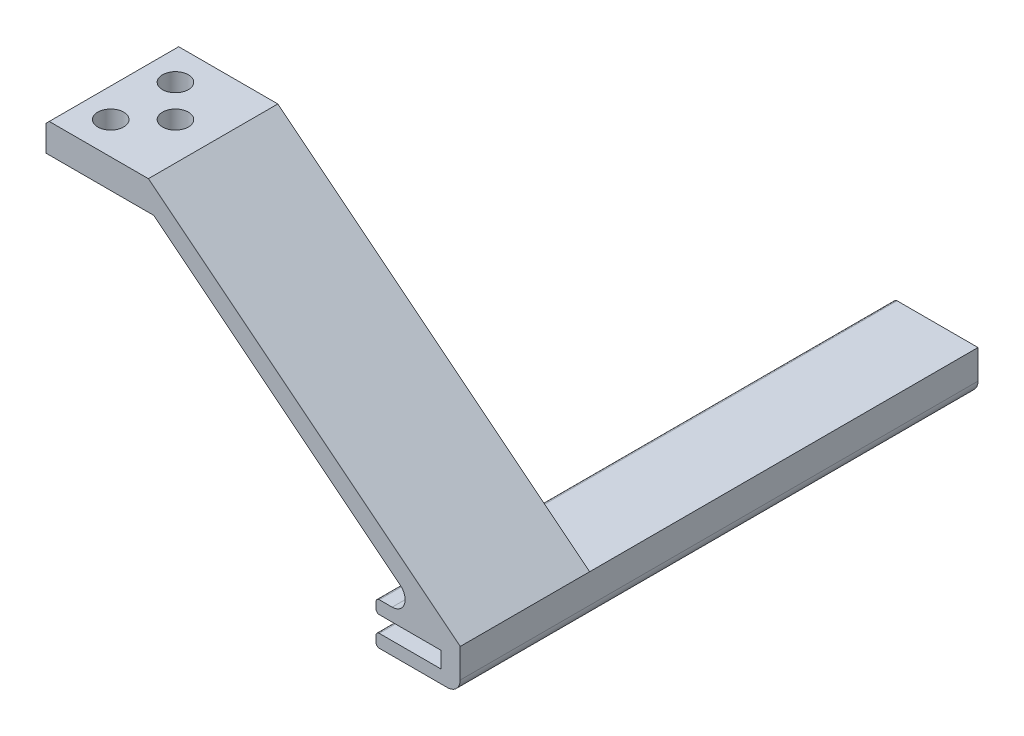
from build123d import *

# Parameters (mm, degrees)
EXTRUDE_1_DEPTH     = 20
SKETCH_2_R          = 2.5
SKETCH_2_W          = 0.5
SKETCH_2_H          = 5
CUT_EXTRUDE_1_DEPTH = 7
FILLET_2_R          = 1
EXTRUDE_START       = 60
EXTRUDE_2_DEPTH     = 60
SKETCH_4_R          = 2
CUT_EXTRUDE_2_DEPTH = 5
CHAMFER_1_SIZE      = 0.5


with BuildPart() as part:
    # 草图1 → 凸台-拉伸1 (new body)
    with BuildSketch(Plane.XY):
        with BuildLine():
            Line((51.5, 0), (62, 0))
            ThreePointArc((62, 0), (63.414213562, 0.585786438), (64, 2))
            Line((64, 2), (64, 6.5))
            Line((64, 6.5), (15.818440015, 45))
            Line((15.818440015, 45), (0, 45))
            Line((0, 45), (0, 40))
            Line((0, 40), (17.27, 40))
            Line((17.27, 40), (54.735914555, 10.062453129))
            ThreePointArc((54.735914555, 10.062453129), (55.374865565, 7.838526742), (53.487419373, 6.5))
            Line((53.487419373, 6.5), (51.5, 6.5))
            ThreePointArc((51.5, 6.5), (51.146446609, 6.353553391), (51, 6))
            Line((51, 6), (51, 5))
            ThreePointArc((51, 5), (51.146446609, 4.646446609), (51.5, 4.5))
            Line((51.5, 4.5), (61, 4.5))
            Line((61, 4.5), (61, 2))
            Line((61, 2), (51.5, 2))
            ThreePointArc((51.5, 2), (51.146446609, 1.853553391), (51, 1.5))
            Line((51, 1.5), (51, 0.5))
            ThreePointArc((51, 0.5), (51.146446609, 0.146446609), (51.5, 0))
        make_face()
    extrude(amount=EXTRUDE_1_DEPTH)

    # 草图2 → 切除-拉伸1 (cut)
    with BuildSketch(Plane.XZ):
        with Locations((57, 14)):
            Circle(SKETCH_2_R)
        with BuildLine():
            Line((57, 16.5), (51.5, 16.5))
            Line((51.5, 16.5), (51.5, 11.5))
            Line((51.5, 11.5), (57, 11.5))
            ThreePointArc((57, 11.5), (54.5, 14), (57, 16.5))
        make_face()
        with Locations((51.25, 14)):
            Rectangle(SKETCH_2_W, SKETCH_2_H)
    extrude(amount=-CUT_EXTRUDE_1_DEPTH, mode=Mode.SUBTRACT)

    # 圆角2
    fillet_2_edges = [part.edges().sort_by_distance(p)[0] for p in [
        (54.810295028, 7, 14),
    ]]
    fillet(fillet_2_edges, radius=FILLET_2_R)

    # 草图3 → 凸台-拉伸2 (add)
    with BuildSketch(Plane(origin=(0, 0, 0), x_dir=(-1, 0, 0), z_dir=(0, 0, -1)).offset(EXTRUDE_START)):
        with BuildLine():
            Line((-64, 6.5), (-53.487419373, 6.5))
            Line((-53.487419373, 6.5), (-51.5, 6.5))
            ThreePointArc((-51.5, 6.5), (-51.146446609, 6.353553391), (-51, 6))
            Line((-51, 6), (-51, 5))
            ThreePointArc((-51, 5), (-51.146446609, 4.646446609), (-51.5, 4.5))
            Line((-51.5, 4.5), (-61, 4.5))
            Line((-61, 4.5), (-61, 2))
            Line((-61, 2), (-51.5, 2))
            ThreePointArc((-51.5, 2), (-51.146446609, 1.853553391), (-51, 1.5))
            Line((-51, 1.5), (-51, 0.5))
            ThreePointArc((-51, 0.5), (-51.146446609, 0.146446609), (-51.5, 0))
            Line((-51.5, 0), (-62, 0))
            ThreePointArc((-62, 0), (-63.414213562, 0.585786438), (-64, 2))
            Line((-64, 2), (-64, 6.5))
        make_face()
    extrude(amount=-EXTRUDE_2_DEPTH)

    # 草图4 → 切除-拉伸2 (cut)
    with BuildSketch(Plane(origin=(0, 45, 0), x_dir=(1, 0, 0), z_dir=(0, 1, 0))):
        with Locations(Location((5, -5, 0), (0, 0, 270))):
            Circle(SKETCH_4_R)
        with Locations(Location((5, -15, 0), (0, 0, 270))):
            Circle(SKETCH_4_R)
        with Locations(Location((10, -10, 0), (0, 0, 270))):
            Circle(SKETCH_4_R)
    extrude(amount=-CUT_EXTRUDE_2_DEPTH, mode=Mode.SUBTRACT)

    # 倒角1
    chamfer_1_edges = [part.edges().sort_by_distance(p)[0] for p in [
        (8.635, 40, 20),
        (8.635, 40, 0),
        (0, 40, 10),
        (0, 45, 10),
    ]]
    chamfer(chamfer_1_edges, length=CHAMFER_1_SIZE)


solid = part.part
